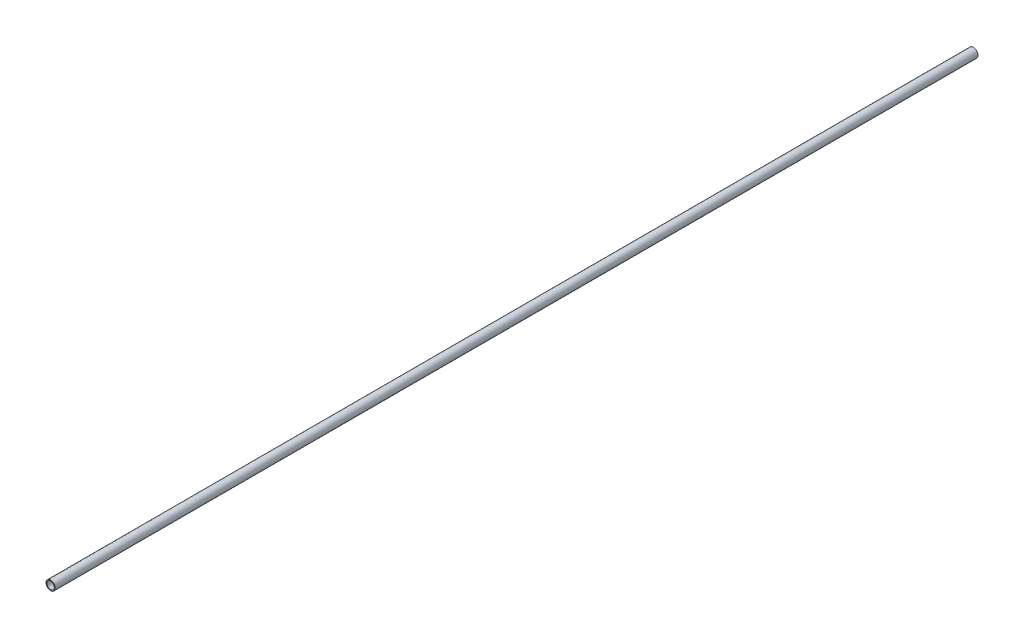
from build123d import *

# Parameters (mm, degrees)
SKETCH1_R           = 10
BOSS_EXTRUDE1_DEPTH = 2000
SKETCH2_R           = 8
CUT_EXTRUDE1_DEPTH  = 2000


with BuildPart() as part:
    # Sketch1 → Boss-Extrude1 (new body)
    with BuildSketch(Plane.XY):
        Circle(SKETCH1_R)
    extrude(amount=BOSS_EXTRUDE1_DEPTH)

    # Sketch2 → Cut-Extrude1 (cut)
    with BuildSketch(Plane.XY.offset(2000)):
        Circle(SKETCH2_R)
    extrude(amount=-CUT_EXTRUDE1_DEPTH, mode=Mode.SUBTRACT)


solid = part.part
